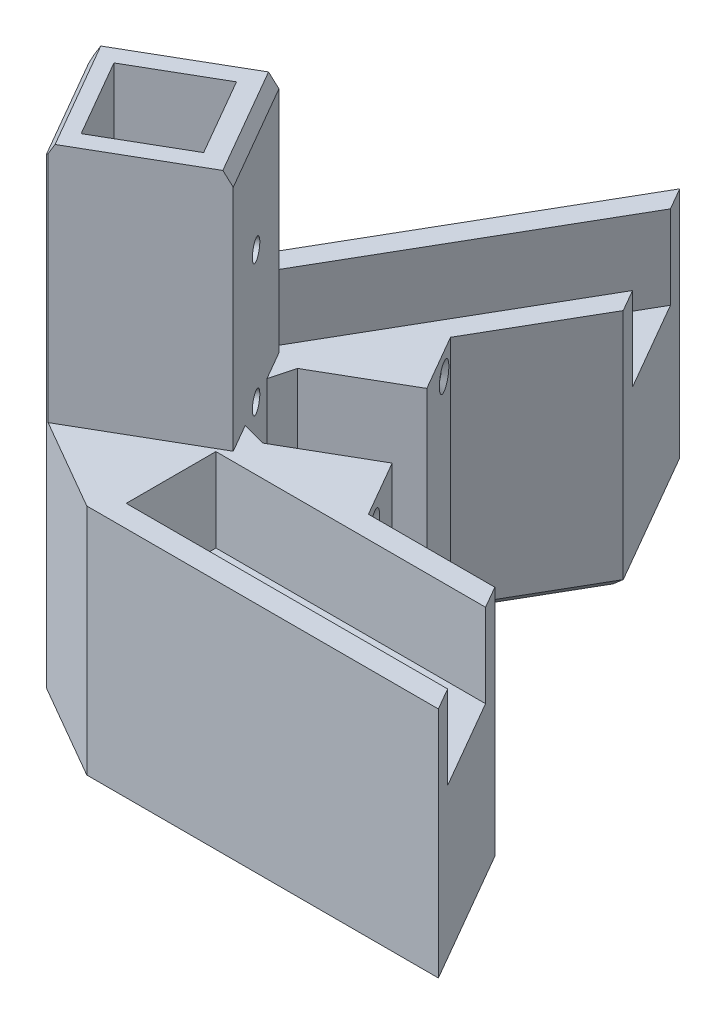
from build123d import *
from OCP.BRepFilletAPI import BRepFilletAPI_MakeChamfer

# Parameters (mm, degrees)
BOSS_EXTRUDE1_DEPTH     = 55
CUT_EXTRUDE2_DEPTH      = 206.91260281973967
CUT_EXTRUDE2_DEPTH_BACK = 206.91260281973967
SKETCH2_W               = 100.40000000000003
SKETCH2_H               = 20.399999999999995
CUT_EXTRUDE3_DEPTH      = 19
CUT_EXTRUDE4_DEPTH      = 206.91260281973967
CUT_EXTRUDE4_DEPTH_BACK = 206.91260281973967
CUT_EXTRUDE12_DEPTH     = 206.91260281973967
BOSS_EXTRUDE2_DEPTH     = 55
CHAMFER1_SIZE           = 14.54
CHAMFER1_SIZE2          = 14.538004892432124
CHAMFER8_SIZE           = 14.54
CHAMFER8_SIZE2          = 14.541995746543376
CHAMFER10_SIZE          = 3
CHAMFER10_SIZE2         = 1.732050807568882
BOSS_EXTRUDE4_DEPTH     = 55
SKETCH39_R              = 1.949999999999999
CUT_EXTRUDE13_DEPTH     = 11
SKETCH40_R              = 2.3000000000000105
SKETCH40_R_2            = 2.2999999999999985
CUT_EXTRUDE14_DEPTH     = 212.78054679313647
SKETCH41_R              = 2.2999999999999927
SKETCH41_R_2            = 2.300000000000006
CUT_EXTRUDE15_DEPTH     = 212.78054679313647
SKETCH42_R              = 5.000000000000005
SKETCH42_R_2            = 5.000000000000004
SKETCH42_R_3            = 4.99999999999999
CUT_EXTRUDE16_DEPTH     = 214.57902518739957
CHAMFER6_SIZE           = 1
CHAMFER13_SIZE          = 2
CHAMFER14_SIZE          = 4
SKETCH35_R              = 2.3
SKETCH35_R_2            = 2.3000000000000007
CUT_EXTRUDE11_DEPTH     = 157.6455394949968
CHAMFER15_SIZE          = 1
CHAMFER12_SIZE          = 2


with BuildPart() as part:
    # Sketch1 → Boss-Extrude1 (new body)
    with BuildSketch(Plane(origin=(0, 0, 0), x_dir=(1, 0, 0), z_dir=(0, 1, 0))):
        Polygon((0, 0), (149.99999999999937, 0), (74.99999999999966, 129.903810567666), align=None)
    extrude(amount=-BOSS_EXTRUDE1_DEPTH)

    # Sketch4 → Cut-Extrude2 (cut, two sides: drawn at the far end of the back side and taken through both)
    with BuildSketch(Plane(origin=(0, 0, 0), x_dir=(1, 0, 0), z_dir=(0, 1, 0)).offset(-CUT_EXTRUDE2_DEPTH_BACK)):
        Polygon((58.51197371389166, 45.56656990669255), (40.84586371751368, 35.365170120590925), (51.0472635036153, 17.699060124212945), (68.71337349999328, 27.90045991031457), align=None)
    extrude(amount=CUT_EXTRUDE2_DEPTH + CUT_EXTRUDE2_DEPTH_BACK, mode=Mode.SUBTRACT)

    # Sketch2 → Cut-Extrude3 (cut)
    with BuildSketch(Plane(origin=(0, 0, 0), x_dir=(1, 0, 0), z_dir=(0, 1, 0))):
        Polygon((109.19704525612455, 138.33483042000623), (58.99704525612457, 51.385879880048556), (41.33012701892186, 61.58587988004866), (91.53012701892203, 148.5348304200062), align=None)
        with Locations((124.20000000000002, 15.199999999999998)):
            Rectangle(SKETCH2_W, SKETCH2_H)
    extrude(amount=-CUT_EXTRUDE3_DEPTH, mode=Mode.SUBTRACT)

    # Sketch27 → Cut-Extrude4 (cut, two sides: drawn at the far end of the back side and taken through both)
    with BuildSketch(Plane(origin=(0, 0, 0), x_dir=(1, 0, 0), z_dir=(0, 1, 0)).offset(-CUT_EXTRUDE4_DEPTH_BACK)):
        Polygon((263.2126301054118, 395.09764853640723), (92.55144818336423, 99.50381056766552), (63.425446507958185, 49.05609584452599), (74.19851948196656, 30.4), (132.44855181663485, 30.400000000000006), (473.7709156607301, 30.40000000000005), (1064.9585915982134, 371.72236384409547), (854.4003060428951, 736.4200123805026), align=None)
    extrude(amount=CUT_EXTRUDE4_DEPTH + CUT_EXTRUDE4_DEPTH_BACK, mode=Mode.SUBTRACT)

    # Sketch36 → Cut-Extrude12 (cut, through all)
    with BuildSketch(Plane(origin=(0, 0, 0), x_dir=(1, 0, 0), z_dir=(0, 1, 0))):
        Polygon((0, 0), (27.744423358828314, 48.054750884192224), (55.49392370110368, 0), align=None)
    extrude(amount=-CUT_EXTRUDE12_DEPTH, mode=Mode.SUBTRACT)

    # Sketch37 → Boss-Extrude2 (add)
    with BuildSketch(Plane(origin=(0, 0, 0), x_dir=(1, 0, 0), z_dir=(0, 1, 0))):
        Polygon((34.51566032896974, 36.328770172306804), (61.707613950845634, 52.03092474503183), (75.90956267267339, 27.436928475564457), (48.717609050797485, 11.734773902839414), align=None)
        Polygon((58.51197371389166, 45.56656990669254), (40.84586371751368, 35.365170120590925), (51.0472635036153, 17.699060124212945), (68.71337349999328, 27.90045991031457), align=None, mode=Mode.SUBTRACT)
    extrude(amount=BOSS_EXTRUDE2_DEPTH)

    # Chamfer1
    chamfer1_edges = [part.edges().sort_by_distance(p)[0] for p in [
        (27.744423358828314, -27.499999999999996, -48.054750884192224),
    ]]
    chamfer1_side = [part.faces().sort_by_distance(p)[0] for p in [
        (41.61831404888806, -8.880686552520038, -24.028863834628613),
    ]]
    chamfer(chamfer1_edges, length=CHAMFER1_SIZE, length2=CHAMFER1_SIZE2, reference=chamfer1_side[0])

    # Chamfer8
    chamfer8_edges = [part.edges().sort_by_distance(p)[0] for p in [
        (55.49392370110368, -27.5, 0),
    ]]
    chamfer8_side = [part.faces().sort_by_distance(p)[0] for p in [
        (43.89644444718681, -5.451869149628209, -20.083748159692625),
    ]]
    chamfer(chamfer8_edges, length=CHAMFER8_SIZE, length2=CHAMFER8_SIZE2, reference=chamfer8_side[0])

    # Chamfer10: one chamfer whose edges measure the first distance from different faces: ONE call of the kernel's chamfer builder (chamfer() names one face for all edges)
    chamfer10_edges_1 = [part.edges().sort_by_distance(p)[0] for p in [
        (41.619173529966076, 55, -24.027375442095966),
    ]]
    chamfer10_side_1 = [part.faces().sort_by_distance(p)[0] for p in [
        (41.61917352996608, 4.8e-16, -24.02737544209596),
    ]]
    chamfer10_edges_2 = [part.edges().sort_by_distance(p)[0] for p in [
        (68.80858831175951, 55, -39.73392661029814),
    ]]
    chamfer10_side_2 = [part.faces().sort_by_distance(p)[0] for p in [
        (68.81005262159329, 3.7755355816469027, -39.731390815296024),
    ]]
    chamfer10 = BRepFilletAPI_MakeChamfer(part.part.solid().wrapped)
    for e in chamfer10_edges_1:
        chamfer10.Add(CHAMFER10_SIZE, CHAMFER10_SIZE2, e.wrapped, chamfer10_side_1[0].wrapped)  # the first distance lies on this face
    for e in chamfer10_edges_2:
        chamfer10.Add(CHAMFER10_SIZE, CHAMFER10_SIZE2, e.wrapped, chamfer10_side_2[0].wrapped)  # the first distance lies on this face
    add(Compound.cast(chamfer10.Shape()), mode=Mode.REPLACE)

    # Sketch28 → Boss-Extrude4 (add)
    with BuildSketch(Plane(origin=(0, 0, 0), x_dir=(1, 0, 0), z_dir=(0, 1, 0))):
        Polygon((63.4254465079582, 49.05609584452599), (78.17205931308985, 74.59797846255982), (85.54536553049708, 61.82937401563315), align=None)
        Polygon((103.69444359160526, 30.4), (74.19851948196656, 30.4), (96.31843850450542, 43.173278171107164), align=None)
    extrude(amount=-BOSS_EXTRUDE4_DEPTH)

    # Sketch39 → Cut-Extrude13 (cut)
    with BuildSketch(Plane(origin=(90.92850733429839, 0, -52.5072047814054), x_dir=(-0.5000686169657652, 0, -0.8659857841361757), z_dir=(0.8659857841361756, 0, -0.5000686169657651))):
        with Locations((-21.499999999999993, -4.999999999999996)):
            Circle(SKETCH39_R)
        with Locations((21.500000000000004, -4.999999999999996)):
            Circle(SKETCH39_R)
        with Locations((21.50000000000001, -47.99999999999999)):
            Circle(SKETCH39_R)
        with Locations((-21.499999999999986, -47.99999999999999)):
            Circle(SKETCH39_R)
    extrude(amount=-CUT_EXTRUDE13_DEPTH, mode=Mode.SUBTRACT)

    # Sketch40 → Cut-Extrude14 (cut, through all)
    with BuildSketch(Plane(origin=(0, -19, 0), x_dir=(1, 0, 0), z_dir=(0, 1, 0))):
        with Locations(Location((76.27572409168204, 101.7134295108992, 0), (0, 0, 270))):
            Circle(SKETCH40_R)
        with Locations(Location((57.66358613752323, 69.47626093681517, 0), (0, 0, 270))):
            Circle(SKETCH40_R_2)
    extrude(amount=-CUT_EXTRUDE14_DEPTH, mode=Mode.SUBTRACT)

    # Sketch41 → Cut-Extrude15 (cut, through all)
    with BuildSketch(Plane(origin=(0, -19, 0), x_dir=(1, 0, 0), z_dir=(0, 1, 0))):
        with Locations(Location((89, 15.2, 0), (0, 0, 270))):
            Circle(SKETCH41_R)
        with Locations(Location((126.22427590831714, 15.199999999999998, 0), (0, 0, 270))):
            Circle(SKETCH41_R_2)
    extrude(amount=-CUT_EXTRUDE15_DEPTH, mode=Mode.SUBTRACT)

    # Sketch42 → Cut-Extrude16 (cut, through all)
    with BuildSketch(Plane(origin=(0, -24, 0), x_dir=(1, 0, 0), z_dir=(0, 1, 0))):
        with Locations(Location((76.27572409168204, 101.7134295108992, 0), (0, 0, 270))):
            Circle(SKETCH42_R)
        with Locations(Location((57.66358613752323, 69.47626093681517, 0), (0, 0, 270))):
            Circle(SKETCH42_R)
        with Locations(Location((89, 15.2, 0), (0, 0, 270))):
            Circle(SKETCH42_R_2)
        with Locations(Location((126.22427590831714, 15.199999999999998, 0), (0, 0, 270))):
            Circle(SKETCH42_R_3)
    extrude(amount=-CUT_EXTRUDE16_DEPTH, mode=Mode.SUBTRACT)

    # Chamfer6
    chamfer6_edges = [part.edges().sort_by_distance(p)[0] for p in [
        (63.612673606942465, -55.00000000000001, -36.73351490850356),
        (59.88031850180429, -55.00000000000001, -22.79976001726376),
        (45.94656361056448, -55.00000000000001, -26.532115122401926),
        (49.67891871570267, -55.00000000000001, -40.465870013641734),
    ]]
    chamfer(chamfer6_edges, length=CHAMFER6_SIZE)

    # Chamfer13
    chamfer13_edges = [part.edges().sort_by_distance(p)[0] for p in [
        (76.27572409168204, -55, -106.7134295108992),
        (57.66358613752323, -55, -74.47626093681517),
        (89, -55, -20.200000000000003),
        (126.22427590831714, -55, -20.19999999999999),
    ]]
    chamfer(chamfer13_edges, length=CHAMFER13_SIZE)

    # Chamfer14
    chamfer14_edges = [part.edges().sort_by_distance(p)[0] for p in [
        (63.425446507958185, -27.5, -49.05609584452599),
        (74.19851948196656, -27.5, -30.4),
    ]]
    chamfer(chamfer14_edges, length=CHAMFER14_SIZE)

    # Sketch35 → Cut-Extrude11 (cut, through all)
    with BuildSketch(Plane(origin=(45.94656361056447, 0, -26.53211512240196), x_dir=(-0.5000686169657652, 0, -0.8659857841361754), z_dir=(0.8659857841361756, 0, -0.5000686169657653))):
        with Locations((3.67e-15, -30)):
            Circle(SKETCH35_R)
        Circle(SKETCH35_R_2)
        with Locations((-3.67e-15, 30)):
            Circle(SKETCH35_R)
    extrude(amount=CUT_EXTRUDE11_DEPTH, mode=Mode.SUBTRACT)

    # Chamfer15
    chamfer15_edges = [part.edges().sort_by_distance(p)[0] for p in [
        (102.65511640214558, -4.999999999999996, -32.19983814341209),
        (81.15216587261767, -47.99999999999999, -69.43722686126765),
        (102.65511640214558, -47.99999999999999, -32.199838143412094),
        (81.15216587261767, -4.999999999999996, -69.43722686126763),
    ]]
    chamfer(chamfer15_edges, length=CHAMFER15_SIZE)

    # Chamfer12
    chamfer12_edges = [part.edges().sort_by_distance(p)[0] for p in [
        (141.2242759083171, -55, -15.200000000000003),
        (35.01442342727759, -55, -48.054175012116296),
        (41.61917352996607, -55.00000000000001, -24.027375442095966),
        (110.01795972382322, -55, 0),
        (59.12942272903427, -55.00000000000001, -6.295716650669986),
        (81.85871242179346, -55, -68.21367623909649),
        (118.07149770412005, -55, -30.400000000000002),
        (86.99045056150834, -55, -37.786776319485114),
        (100.00644104805534, -55, -36.78663908555358),
        (76.21737758749998, -55, -56.44287216401109),
        (68.81198299496236, -55, -39.728047922263),
        (66.15755531016205, -55, -48.324261510185174),
        (74.93035381630737, -55, -33.13210880220387),
        (55.006712902522075, -55, -95.27442150452332),
        (83.77572409168201, -55, -114.70381056766587),
        (85.36175374822707, -55.00000000000001, -87.05089451511276),
    ]]
    chamfer(chamfer12_edges, length=CHAMFER12_SIZE)


solid = part.part
